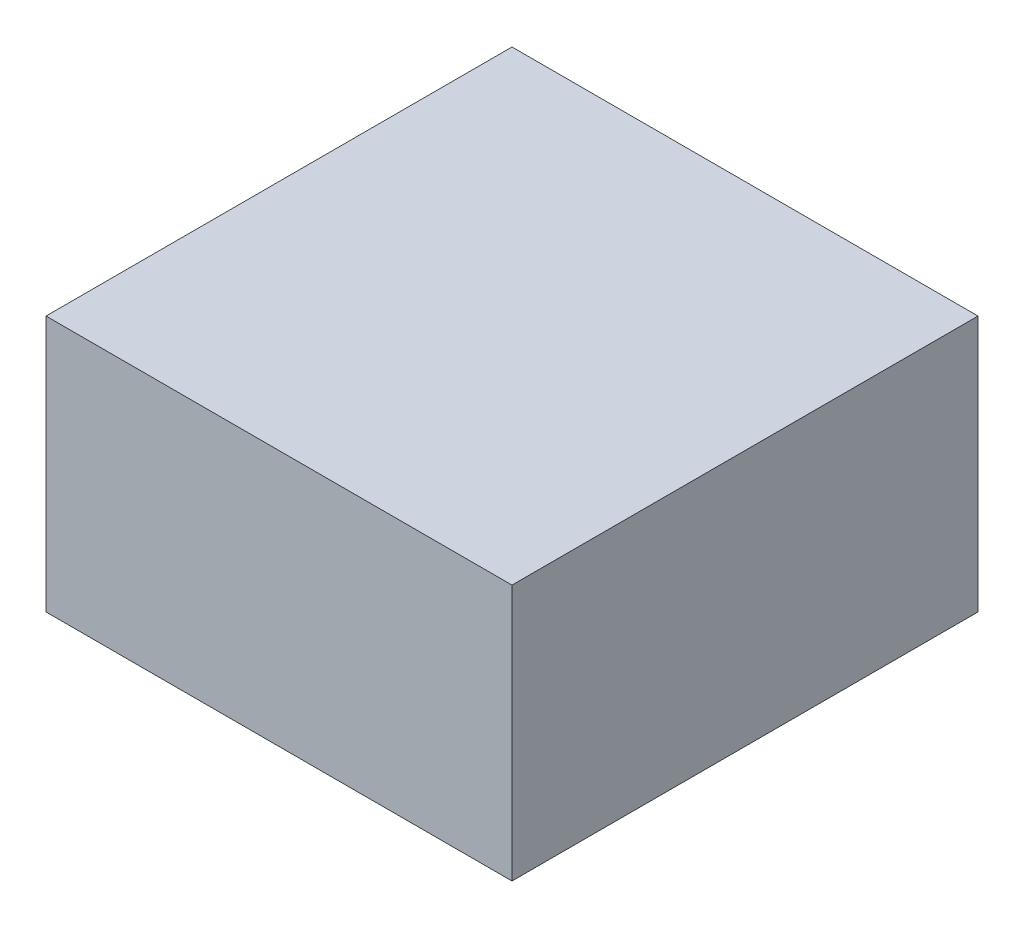
from build123d import *

# Parameters (mm, degrees)
SKETCH1_W           = 10
SKETCH1_H           = 10
BOSS_EXTRUDE1_DEPTH = 5.5


with BuildPart() as part:
    # Sketch1 → Boss-Extrude1 (new body)
    with BuildSketch(Plane(origin=(0, 0, 0), x_dir=(1, 0, 0), z_dir=(0, 1, 0))):
        Rectangle(SKETCH1_W, SKETCH1_H)
    extrude(amount=BOSS_EXTRUDE1_DEPTH)


solid = part.part
